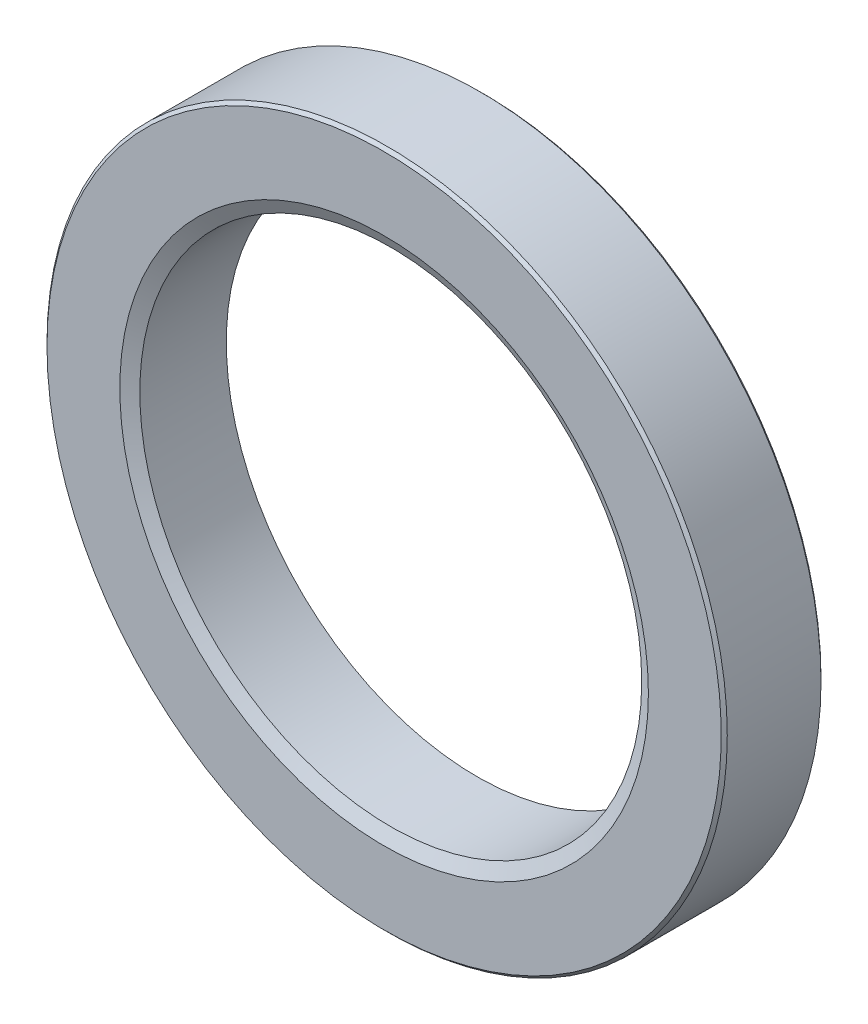
from build123d import *

# Parameters (mm, degrees)
CHAMFER_1_SIZE = 1


with BuildPart() as part:
    # 草图1 → 旋转1 (revolve)
    with BuildSketch(Plane(origin=(0, 0, 0), x_dir=(0, 0, -1), z_dir=(1, 0, 0)), mode=Mode.PRIVATE) as revolve_1_sk:
        Polygon((14.3, 83), (-14.3, 83), (-16.5, 87.412517358), (-16.5, 112.5), (16.5, 112.5), (16.5, 87.412517358), align=None)
    revolve(revolve_1_sk.sketch.rotate(Axis((0, 0, 15.038452749), (0, 0, -1)), 90), axis=Axis((0, 0, 15.038452749), (0, 0, -1)))

    # 倒角1
    chamfer_1_edges = [part.edges().sort_by_distance(p)[0] for p in [
        (-112.5, 0, -16.5),
        (-112.5, 0, 16.5),
    ]]
    chamfer(chamfer_1_edges, length=CHAMFER_1_SIZE)


solid = part.part
